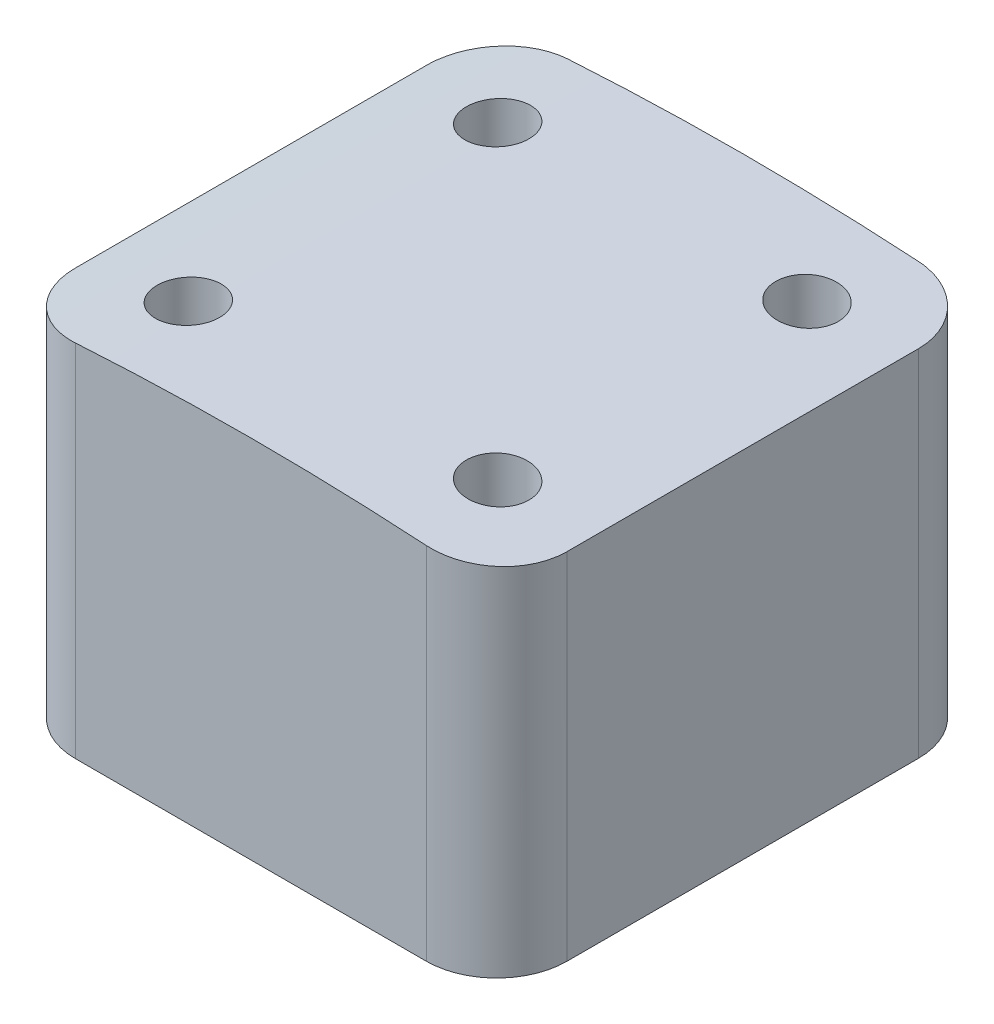
from build123d import *

# Parameters (mm, degrees)
BOSS_EXTRUDE1_DEPTH              = 8.89
BOSS_EXTRUDE1_DEPTH_BACK         = 8.89
F_3_8_0_375_DIAMETER_SLOT1_D     = 9.525
F_3_8_0_375_DIAMETER_SLOT1_DEPTH = 9.652
F_3_8_0_375_DIAMETER_SLOT1_TIP   = 2.861598698
TAP_DRILL_FOR_4_40_TAP1_D        = 2.2606
FILLET1_R                        = 2.54


with BuildPart() as part:
    # Sketch1 → Boss-Extrude1 (new, two sides: drawn at the far end of the back side and taken through both)
    with BuildSketch(Plane.XY.offset(-BOSS_EXTRUDE1_DEPTH_BACK)):
        with BuildLine():
            Line((8.853671113, 101.352246104), (8.853671113, 88.534433979))
            Line((8.853671113, 88.534433979), (-8.902635044, 88.534433979))
            Line((-8.902635044, 88.534433979), (-8.902635044, 101.350105765))
            ThreePointArc((-8.902635044, 101.350105765), (-0.024528813, 101.739820854), (8.853671113, 101.352246104))
        make_face()
    extrude(amount=BOSS_EXTRUDE1_DEPTH + BOSS_EXTRUDE1_DEPTH_BACK)

    # 3/8 (0.375) Diameter Slot1
    with Locations(Plane(origin=(0, 88.534433979, 0), x_dir=(-1, 0, 0), z_dir=(0, -1, 0))):
        with Locations((0, 0)):
            Hole(F_3_8_0_375_DIAMETER_SLOT1_D / 2, depth=F_3_8_0_375_DIAMETER_SLOT1_DEPTH)
            with Locations((0, 0, -(F_3_8_0_375_DIAMETER_SLOT1_DEPTH + F_3_8_0_375_DIAMETER_SLOT1_TIP / 2))):  # 118° drill point
                Cone(0, F_3_8_0_375_DIAMETER_SLOT1_D / 2, F_3_8_0_375_DIAMETER_SLOT1_TIP, mode=Mode.SUBTRACT)

    # Tap Drill for #4-40 Tap1 (through all)
    with Locations(Plane(origin=(0, 88.534433979, 0), x_dir=(-1, 0, 0), z_dir=(0, -1, 0))):
        with Locations((-5.588, 5.588), (5.588, 5.588), (5.588, -5.588), (-5.588, -5.588)):
            Hole(TAP_DRILL_FOR_4_40_TAP1_D / 2)

    # Fillet1
    fillet1_edges = [part.edges().sort_by_distance(p)[0] for p in [
        (-8.902635044, 94.942269872, 8.89),
        (8.853671113, 94.943340042, -8.89),
        (8.853671113, 94.943340042, 8.89),
        (-8.902635044, 94.942269872, -8.89),
    ]]
    fillet(fillet1_edges, radius=FILLET1_R)


solid = part.part
